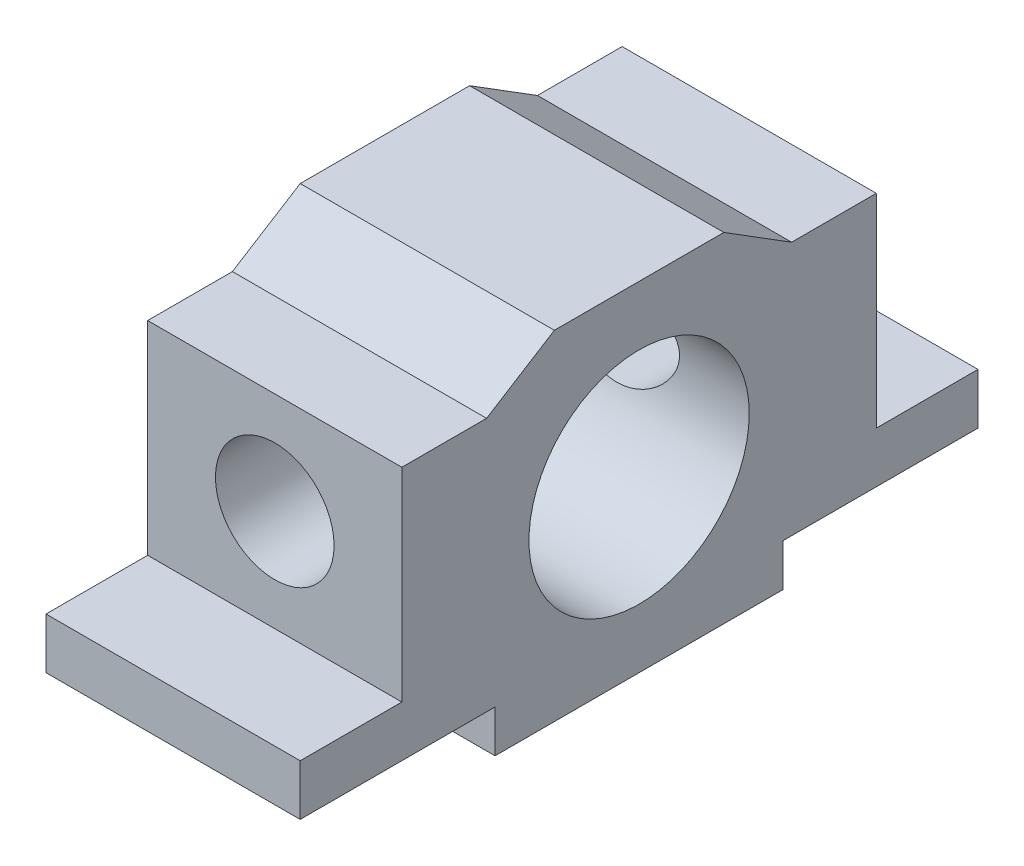
from build123d import *

# Parameters (mm, degrees)
SKETCH1_W           = 30
SKETCH1_H           = 40
BOSS_EXTRUDE1_DEPTH = 40
SKETCH2_W           = 30
SKETCH2_H           = 5
CUT_EXTRUDE1_DEPTH  = 23
SKETCH3_W           = 30
SKETCH3_H           = 5
CUT_EXTRUDE2_DEPTH  = 23
SKETCH5_W           = 12
SKETCH5_H           = 29
CUT_EXTRUDE3_DEPTH  = 65.031242374
CUT_EXTRUDE4_DEPTH  = 65.031242374
SKETCH7_R           = 13
CUT_EXTRUDE5_DEPTH  = 65.031242374
SKETCH8_R           = 7
CUT_EXTRUDE6_DEPTH  = 85.403791384


with BuildPart() as part:
    # Sketch1 → Boss-Extrude1 (new, symmetric)
    with BuildSketch(Plane.XY):
        with Locations((15, 20)):
            Rectangle(SKETCH1_W, SKETCH1_H)
    extrude(amount=BOSS_EXTRUDE1_DEPTH, both=True)

    # Sketch2 → Cut-Extrude1 (cut)
    with BuildSketch(Plane.XY.offset(40)):
        with Locations((15, 2.5)):
            Rectangle(SKETCH2_W, SKETCH2_H)
    extrude(amount=-CUT_EXTRUDE1_DEPTH, mode=Mode.SUBTRACT)

    # Sketch3 → Cut-Extrude2 (cut)
    with BuildSketch(Plane(origin=(0, 0, -40), x_dir=(-1, 0, 0), z_dir=(0, 0, -1))):
        with Locations((-15, 2.5)):
            Rectangle(SKETCH3_W, SKETCH3_H)
    extrude(amount=-CUT_EXTRUDE2_DEPTH, mode=Mode.SUBTRACT)

    # Sketch5 → Cut-Extrude3 (cut, through all)
    with BuildSketch(Plane(origin=(0, 0, 0), x_dir=(0, 0, -1), z_dir=(1, 0, 0))):
        with Locations((-34, 25.5)):
            Rectangle(SKETCH5_W, SKETCH5_H)
        with Locations((34, 25.5)):
            Rectangle(SKETCH5_W, SKETCH5_H)
    extrude(amount=CUT_EXTRUDE3_DEPTH, mode=Mode.SUBTRACT)

    # Sketch6 → Cut-Extrude4 (cut, through all)
    with BuildSketch(Plane(origin=(30, 0, 0), x_dir=(0, 0, -1), z_dir=(1, 0, 0))):
        Polygon((-28, 35), (-18, 35), (-10, 40), (-28, 40), align=None)
        Polygon((10, 40), (18, 35), (28, 35), (28, 40), align=None)
    extrude(amount=-CUT_EXTRUDE4_DEPTH, mode=Mode.SUBTRACT)

    # Sketch7 → Cut-Extrude5 (cut, through all)
    with BuildSketch(Plane(origin=(30, 0, 0), x_dir=(0, 0, -1), z_dir=(1, 0, 0))):
        with Locations((0, 20)):
            Circle(SKETCH7_R)
    extrude(amount=-CUT_EXTRUDE5_DEPTH, mode=Mode.SUBTRACT)

    # Sketch8 → Cut-Extrude6 (cut, through all)
    with BuildSketch(Plane.XY.offset(28)):
        with Locations((15, 23)):
            Circle(SKETCH8_R)
    extrude(amount=-CUT_EXTRUDE6_DEPTH, mode=Mode.SUBTRACT)


solid = part.part
